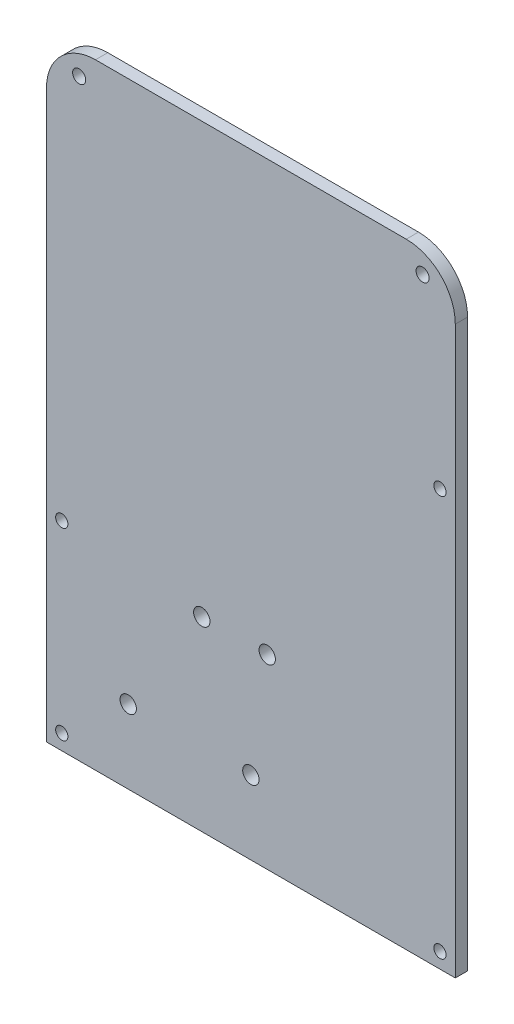
from build123d import *

# Parameters (mm, degrees)
SKETCH1_W           = 100
SKETCH1_H           = 150.5
BOSS_EXTRUDE1_DEPTH = 3
SKETCH2_R           = 1.5
CUT_EXTRUDE1_DEPTH  = 3
SKETCH3_R           = 2
CUT_EXTRUDE2_DEPTH  = 3
FILLET1_R           = 12
SKETCH4_R           = 1.6
CUT_EXTRUDE3_DEPTH  = 10


with BuildPart() as part:
    # Sketch1 → Boss-Extrude1 (new body)
    with BuildSketch(Plane.XY):
        with Locations((-110.534791728, -38.017977095)):
            Rectangle(SKETCH1_W, SKETCH1_H)
    extrude(amount=BOSS_EXTRUDE1_DEPTH)

    # Sketch2 → Cut-Extrude1 (cut)
    with BuildSketch(Plane.XY.offset(3)):
        with Locations((-156.784791728, -109.517977095)):
            Circle(SKETCH2_R)
        with Locations((-64.284791728, -109.517977095)):
            Circle(SKETCH2_R)
        with Locations((-64.284791728, -11.517977095)):
            Circle(SKETCH2_R)
        with Locations((-156.784791728, -64.517977095)):
            Circle(SKETCH2_R)
    extrude(amount=-CUT_EXTRUDE1_DEPTH, mode=Mode.SUBTRACT)

    # Sketch3 → Cut-Extrude2 (cut)
    with BuildSketch(Plane.XY.offset(3)):
        with Locations((-140.534791728, -95.267977095)):
            Circle(SKETCH3_R)
        with Locations((-110.534791728, -95.267977095)):
            Circle(SKETCH3_R)
        with Locations((-106.534791728, -67.767977095)):
            Circle(SKETCH3_R)
        with Locations((-122.534791728, -67.767977095)):
            Circle(SKETCH3_R)
    extrude(amount=-CUT_EXTRUDE2_DEPTH, mode=Mode.SUBTRACT)

    # Fillet1
    fillet1_edges = [part.edges().sort_by_distance(p)[0] for p in [
        (-160.534791728, 37.232022905, 1.5),
        (-60.534791728, 37.232022905, 1.5),
    ]]
    fillet(fillet1_edges, radius=FILLET1_R)

    # Sketch4 → Cut-Extrude3 (cut)
    with BuildSketch(Plane.XY.offset(3)):
        with Locations((-152.534791728, 31.732022905)):
            Circle(SKETCH4_R)
        with Locations((-68.534791728, 31.732022905)):
            Circle(SKETCH4_R)
    extrude(amount=-CUT_EXTRUDE3_DEPTH, mode=Mode.SUBTRACT)


solid = part.part
